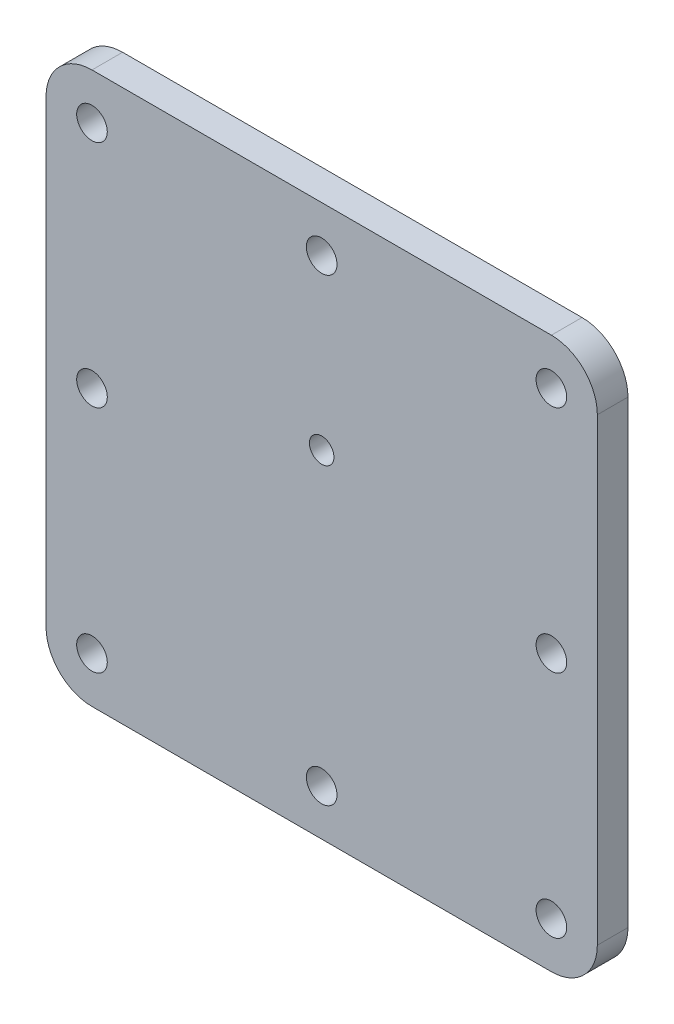
from build123d import *

# Parameters (mm, degrees)
SKETCH2_R           = 5
BOSS_EXTRUDE1_DEPTH = 10
SKETCH5_R           = 4
CUT_EXTRUDE3_DEPTH  = 10


with BuildPart() as part:
    # Sketch2 → Boss-Extrude1 (new body)
    with BuildSketch(Plane.XY):
        with BuildLine():
            Line((-75, 90), (75, 90))
            ThreePointArc((75, 90), (85.606601718, 85.606601718), (90, 75))
            Line((90, 75), (90, -75))
            ThreePointArc((90, -75), (85.606601718, -85.606601718), (75, -90))
            Line((75, -90), (-75, -90))
            ThreePointArc((-75, -90), (-85.606601718, -85.606601718), (-90, -75))
            Line((-90, -75), (-90, 75))
            ThreePointArc((-90, 75), (-85.606601718, 85.606601718), (-75, 90))
        make_face()
        with Locations((-75, 75)):
            Circle(SKETCH2_R, mode=Mode.SUBTRACT)
        with Locations((0, 75)):
            Circle(SKETCH2_R, mode=Mode.SUBTRACT)
        with Locations((75, 75)):
            Circle(SKETCH2_R, mode=Mode.SUBTRACT)
        with Locations((-75, 0)):
            Circle(SKETCH2_R, mode=Mode.SUBTRACT)
        with Locations((75, 0)):
            Circle(SKETCH2_R, mode=Mode.SUBTRACT)
        with Locations((-75, -75)):
            Circle(SKETCH2_R, mode=Mode.SUBTRACT)
        with Locations((0, -75)):
            Circle(SKETCH2_R, mode=Mode.SUBTRACT)
        with Locations((75, -75)):
            Circle(SKETCH2_R, mode=Mode.SUBTRACT)
    extrude(amount=BOSS_EXTRUDE1_DEPTH)

    # Sketch5 → Cut-Extrude3 (cut)
    with BuildSketch(Plane.XY.offset(10)):
        with Locations((0, 20)):
            Circle(SKETCH5_R)
    extrude(amount=-CUT_EXTRUDE3_DEPTH, mode=Mode.SUBTRACT)


solid = part.part
